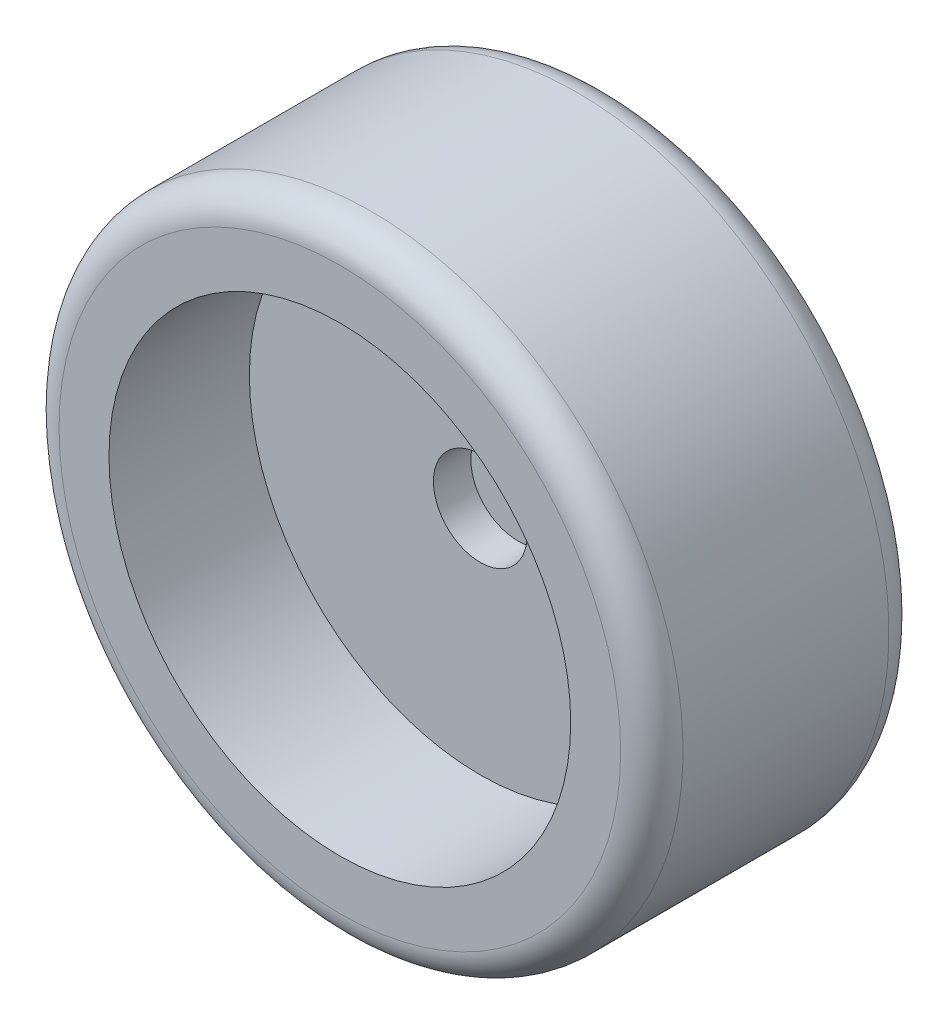
from build123d import *


with BuildPart() as part:
    # Sketch1 → Revolve1 (revolve)
    with BuildSketch(Plane.XZ, mode=Mode.PRIVATE) as revolve1_sk:
        with BuildLine():
            Line((7.5, 14.5), (0, 14.5))
            Line((0, 14.5), (0, 0))
            Line((0, 0), (45, 0))
            ThreePointArc((45, 0), (48.535533906, 1.464466094), (50, 5))
            Line((50, 5), (50, 38))
            ThreePointArc((50, 38), (48.535533906, 41.535533906), (45, 43))
            Line((45, 43), (37, 43))
            Line((37, 43), (37, 20.5))
            Line((37, 20.5), (7.5, 20.5))
            Line((7.5, 20.5), (7.5, 14.5))
        make_face()
    revolve(revolve1_sk.sketch.rotate(Axis((0, 0, 43), (0, 0, -1)), 180), axis=Axis((0, 0, 43), (0, 0, -1)))


solid = part.part
